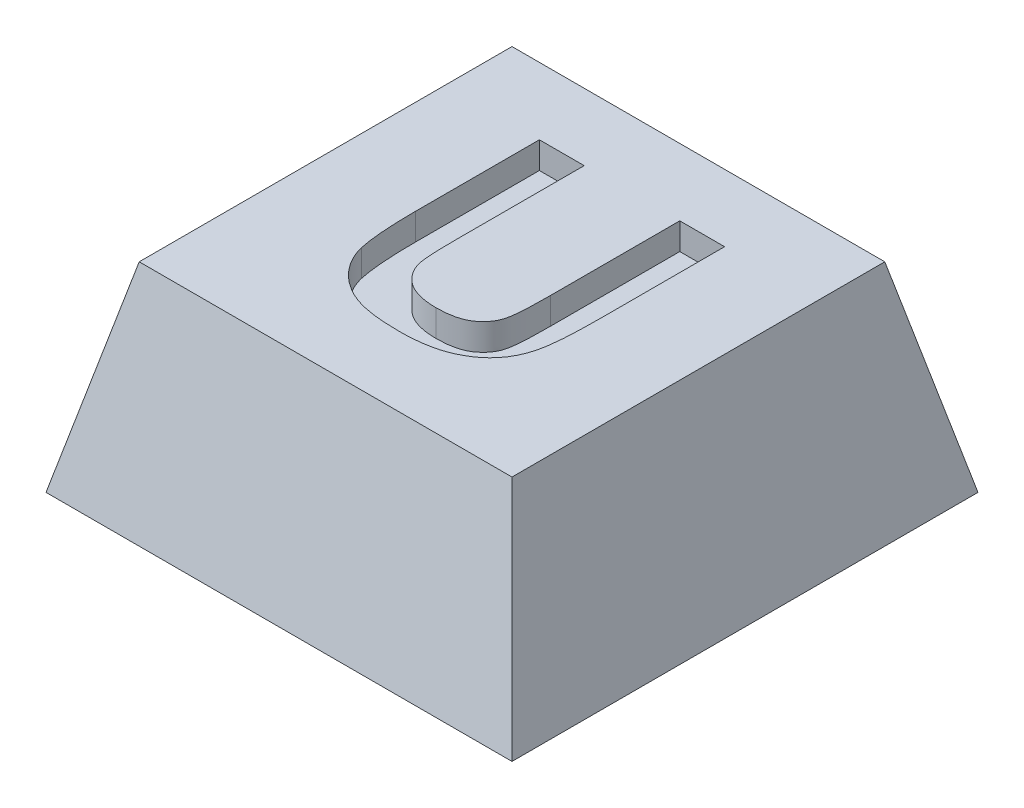
from build123d import *

# Parameters (mm, degrees)
SKETCH1_W           = 7
SKETCH1_H           = 7
BOSS_EXTRUDE1_DEPTH = 3
CUT_EXTRUDE1_DEPTH  = 7
CUT_EXTRUDE2_DEPTH  = 11
SKETCH4_R           = 1.8
CUT_EXTRUDE3_DEPTH  = 0.8
CUT_EXTRUDE4_DEPTH  = 0.4


with BuildPart() as part:
    # Sketch1 → Boss-Extrude1 (new body)
    with BuildSketch(Plane(origin=(0, 0, 0), x_dir=(1, 0, 0), z_dir=(0, 1, 0))):
        with Locations((3.5, 3.5)):
            Rectangle(SKETCH1_W, SKETCH1_H)
    extrude(amount=BOSS_EXTRUDE1_DEPTH)

    # Sketch2 → Cut-Extrude1 (cut)
    with BuildSketch(Plane.XY):
        Polygon((0, 0), (0.7, 3), (0, 3), align=None)
        Polygon((7, 0), (6.3, 3), (7, 3), align=None)
    extrude(amount=-CUT_EXTRUDE1_DEPTH, mode=Mode.SUBTRACT)

    # Sketch3 → Cut-Extrude2 (cut)
    with BuildSketch(Plane(origin=(0, 0, 0), x_dir=(0, 0, -1), z_dir=(1, 0, 0))):
        Polygon((0, 0), (0.7, 3), (0, 3), align=None)
        Polygon((7, 3), (6.3, 3), (7, 0), align=None)
    extrude(amount=CUT_EXTRUDE2_DEPTH, mode=Mode.SUBTRACT)

    # Sketch4 → Cut-Extrude3 (cut)
    with BuildSketch(Plane.XZ):
        with Locations(Location((3.5, -3.5, 0), (0, 0, 270))):
            Circle(SKETCH4_R)
    extrude(amount=-CUT_EXTRUDE3_DEPTH, mode=Mode.SUBTRACT)

    # Sketch5 → Cut-Extrude4 (cut)
    with BuildSketch(Plane(origin=(0, 3, 0), x_dir=(1, 0, 0), z_dir=(0, 1, 0))):
        with BuildLine():
            Line((2.118256711, 5.29301719), (2.791333634, 5.29301719))
            Line((2.791333634, 5.29301719), (2.791333634, 3.393678247))
            add(Edge.make_bspline(
                [(2.791333634, 3.393678247), (2.79159059, 3.357687368), (2.792081143, 3.288977364), (2.792418818, 3.190811929), (2.794287554, 3.102674552), (2.798340091, 3.024423212), (2.801121459, 2.956097816), (2.806286157, 2.897685825), (2.811438338, 2.849209985), (2.816447496, 2.820376155), (2.818677384, 2.807540427)],
                knots=[0, 0, 0, 0, 1.470600056, 2.807515117, 4.011048972, 5.072079398, 6.00911328, 6.804506435, 7.467811572, 8, 8, 8, 8], degree=3))
            add(Edge.make_bspline(
                [(2.818677384, 2.807540427), (2.827870656, 2.772937179), (2.845973369, 2.704799015), (2.895871105, 2.611655954), (2.961785309, 2.529556211), (3.029020227, 2.471005878), (3.08983939, 2.429568298), (3.141500286, 2.404348789), (3.196312159, 2.381359585), (3.255433761, 2.363720163), (3.318230563, 2.348285034), (3.385461086, 2.339360335), (3.456557942, 2.33251085), (3.505290309, 2.331828921), (3.530316005, 2.331478728)],
                knots=[0, 0, 0, 0, 1.376921055, 2.711331395, 4.038631339, 5.418057255, 6.132954575, 6.870556231, 7.630397752, 8.422890386, 9.247036838, 10.121396817, 11.035274583, 12, 12, 12, 12], degree=3))
            add(Edge.make_bspline(
                [(3.530316005, 2.331478728), (3.555564197, 2.331936651), (3.604721911, 2.332828219), (3.67595983, 2.338137813), (3.742423591, 2.348155186), (3.804072535, 2.361289897), (3.86123227, 2.37788997), (3.913446785, 2.398907615), (3.960633797, 2.424200444), (4.016077825, 2.462322988), (4.075735526, 2.516101492), (4.133148446, 2.589220237), (4.174238425, 2.669935378), (4.193511366, 2.743634339), (4.203417011, 2.807845981), (4.209452062, 2.864033397), (4.214971422, 2.927618056), (4.219983422, 2.9984258), (4.223410988, 3.07650978), (4.225264898, 3.162067474), (4.226723935, 3.255085239), (4.227057995, 3.319592414), (4.22723107, 3.353013183)],
                knots=[0, 0, 0, 0, 1.036876239, 2.018776863, 2.930845756, 3.794842666, 4.605604932, 5.371924355, 6.101864688, 6.799283669, 8.1310906, 9.382718023, 10.597336334, 11.822035891, 12.492591141, 13.265194674, 14.141890321, 15.11351293, 16.179860579, 17.351049011, 18.627594861, 20, 20, 20, 20], degree=3))
            Line((4.22723107, 3.353013183), (4.22723107, 5.29301719))
            Line((4.22723107, 5.29301719), (4.900307993, 5.29301719))
            Line((4.900307993, 5.29301719), (4.900307993, 3.462388183))
            add(Edge.make_bspline(
                [(4.900307993, 3.462388183), (4.900221723, 3.411906909), (4.900055958, 3.314908527), (4.897467772, 3.175352057), (4.891967054, 3.047314846), (4.887360678, 2.930577419), (4.878475168, 2.825437586), (4.86917207, 2.731829975), (4.85718756, 2.649770945), (4.840097538, 2.556498932), (4.811376645, 2.451853735), (4.765088439, 2.336259695), (4.705930722, 2.231093862), (4.634139223, 2.135952726), (4.550127521, 2.050458146), (4.452637717, 1.97494623), (4.342672295, 1.908498965), (4.241901685, 1.860652783), (4.154042624, 1.828434731), (4.082482889, 1.806630998), (4.005897563, 1.788473049), (3.924376469, 1.774063102), (3.837884577, 1.761913385), (3.746390484, 1.753799365), (3.650032611, 1.748735644), (3.584309093, 1.748345307), (3.550648537, 1.748145395)],
                knots=[0, 0, 0, 0, 1.415574045, 2.719986624, 3.913607924, 5.00929969, 5.995467356, 6.871900228, 7.64671288, 8.320227872, 9.530145585, 10.682614022, 11.803571353, 12.90325401, 14.015460715, 15.154679255, 16.351678057, 17.612271512, 18.275764165, 18.974412946, 19.708786676, 20.481351116, 21.295095879, 22.157200529, 23.056203067, 24, 24, 24, 24], degree=3))
            add(Edge.make_bspline(
                [(3.550648537, 1.748145395), (3.510214347, 1.748662249), (3.431887293, 1.749663472), (3.318189063, 1.754129843), (3.212251246, 1.763348604), (3.113741005, 1.775808622), (3.022699014, 1.791826383), (2.938894957, 1.810975517), (2.862997887, 1.835177319), (2.772598387, 1.869743344), (2.671833064, 1.922617774), (2.562145747, 1.993151834), (2.465859145, 2.072762044), (2.383819281, 2.160670513), (2.315237148, 2.253787937), (2.259491992, 2.350099358), (2.214819658, 2.447999484), (2.196153021, 2.516041987), (2.186966646, 2.549527606)],
                knots=[0, 0, 0, 0, 1.128613534, 2.186292659, 3.174878439, 4.095586888, 4.95671962, 5.754129884, 6.492676435, 7.178284149, 8.453103036, 9.659838108, 10.813193309, 11.929983019, 13.007587775, 14.033493319, 15.032227051, 16, 16, 16, 16], degree=3))
            add(Edge.make_bspline(
                [(2.186966646, 2.549527606), (2.181344262, 2.575890465), (2.169501722, 2.631419074), (2.156051883, 2.719698679), (2.143781668, 2.816909308), (2.135400951, 2.923165946), (2.127456798, 3.038131461), (2.121753178, 3.16202262), (2.119407844, 3.294811291), (2.118648152, 3.386432941), (2.118256711, 3.43364219)],
                knots=[0, 0, 0, 0, 0.728071598, 1.533551606, 2.411422299, 3.374601532, 4.412367648, 5.524718474, 6.72457895, 8, 8, 8, 8], degree=3))
            Line((2.118256711, 3.43364219), (2.118256711, 5.29301719))
        make_face()
    extrude(amount=-CUT_EXTRUDE4_DEPTH, mode=Mode.SUBTRACT)


solid = part.part
